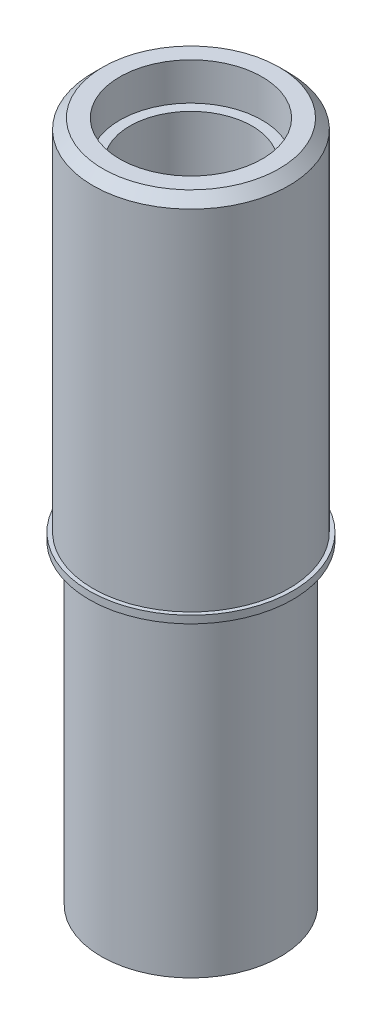
from build123d import *

# Parameters (mm, degrees)
CHAMFER1_SIZE = 1.524


with BuildPart() as part:
    # Sketch1 → Revolve1 (revolve)
    with BuildSketch(Plane(origin=(0, 0, 0), x_dir=(0, 0, -1), z_dir=(1, 0, 0)), mode=Mode.PRIVATE) as revolve1_sk:
        Polygon((11.09345, -53.086), (11.09345, -47.244), (9.525, -47.244), (9.525, 47.244), (11.09345, 47.244), (11.09345, 53.086), (15.2527, 53.086), (15.2527, -2.794000024), (15.875, -2.794000024), (15.875, -3.961), (13.97, -3.961), (13.97, -53.086), align=None)
    revolve(revolve1_sk.sketch.rotate(Axis((0, 53.086, 0), (0, -1, 0)), 180), axis=Axis((0, 53.086, 0), (0, -1, 0)))

    # Chamfer1
    chamfer1_edges = [part.edges().sort_by_distance(p)[0] for p in [
        (0, 53.086, -15.2527),
    ]]
    chamfer(chamfer1_edges, length=CHAMFER1_SIZE)


solid = part.part
